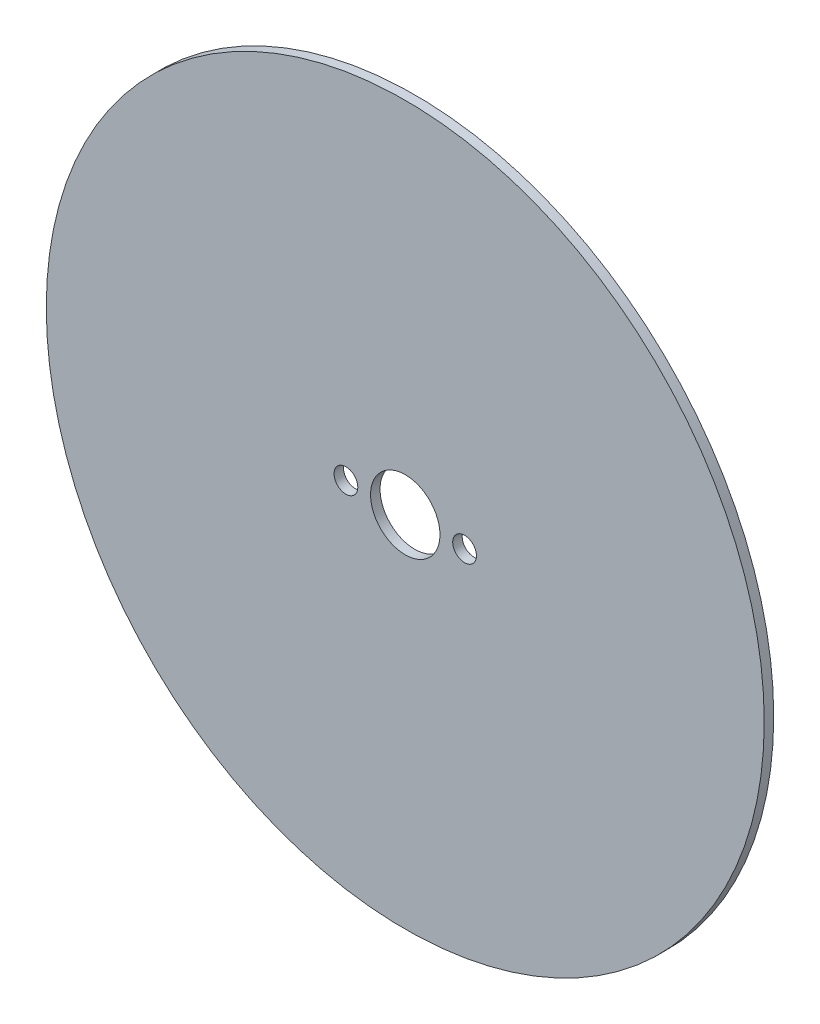
from build123d import *

# Parameters (mm, degrees)
ESQUISSE1_R        = 30.253889757
ESQUISSE1_R_2      = 1
ESQUISSE1_R_3      = 2.925
BOSS_EXTRU_1_DEPTH = 0.8


with BuildPart() as part:
    # Esquisse1 → Boss.-Extru.1 (new body)
    with BuildSketch(Plane.XY):
        Circle(ESQUISSE1_R)
        with Locations((5, 0)):
            Circle(ESQUISSE1_R_2, mode=Mode.SUBTRACT)
        Circle(ESQUISSE1_R_3, mode=Mode.SUBTRACT)
        with Locations((-5, 0)):
            Circle(ESQUISSE1_R_2, mode=Mode.SUBTRACT)
    extrude(amount=-BOSS_EXTRU_1_DEPTH)


solid = part.part
